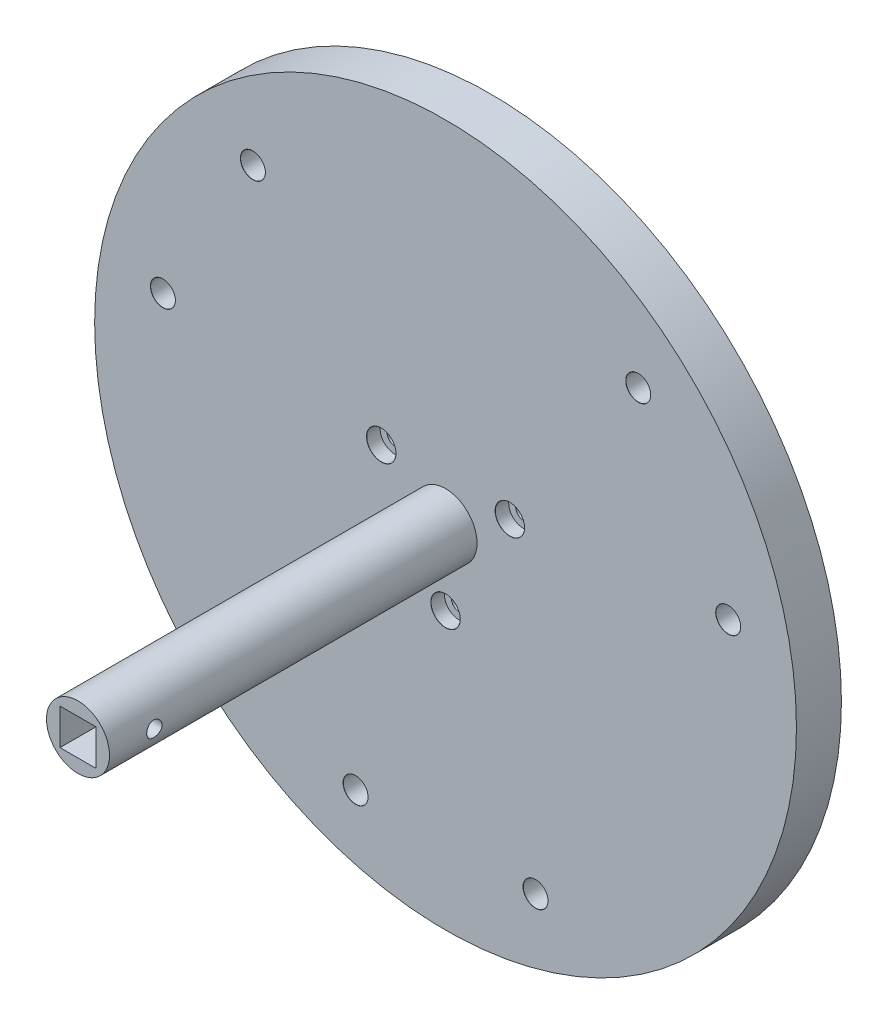
from build123d import *

# Parameters (mm, degrees)
SKETCH1_R                      = 78
BOSS_EXTRUDE1_DEPTH            = 10
CBORE_FOR_M3_SHCS1_AT_2_COUNT  = 2
CBORE_FOR_M3_SHCS1_AT_2_PITCH  = 28.578838325
CBORE_FOR_M3_SHCS1_AT_3_COUNT  = 2
CBORE_FOR_M3_SHCS1_AT_3_PITCH  = 28.578838325
SKETCH6_R                      = 7
BOSS_EXTRUDE2_DEPTH            = 81.7
SKETCH20_W                     = 8
SKETCH20_H                     = 8
CUT_EXTRUDE1_DEPTH             = 20
M5_CLEARANCE_HOLE3_D           = 5.5
M5_CLEARANCE_HOLE3_CSINK_D     = 5.55
M5_CLEARANCE_HOLE3_CSINK_ANGLE = 90
CIRPATTERN1_COUNT              = 3
M3_CLEARANCE_HOLE2_D           = 3.4
M3_CLEARANCE_HOLE2_CSINK_D     = 3.45
M3_CLEARANCE_HOLE2_CSINK_ANGLE = 90


with BuildPart() as part:
    # Sketch1 → Boss-Extrude1 (new body)
    with BuildSketch(Plane.XY):
        Circle(SKETCH1_R)
    extrude(amount=BOSS_EXTRUDE1_DEPTH)

    # Sketch4 → CBORE for M3 SHCS1 (revolve, cut)
    with BuildSketch(Plane(origin=(-14.289419162, 8.25, 10), x_dir=(0, -1, 0), z_dir=(1, 0, 0))):
        Polygon((0, 0), (0, 10), (1.7, 10), (1.7, 3), (3.25, 3), (3.25, 0.025), (3.275, 0), align=None)
    cbore_for_m3_shcs1 = revolve(axis=Axis((-14.289419162, 8.25, 16.35), (0, 0, -1)), mode=Mode.SUBTRACT)

    # CBORE for M3 SHCS1 at 2: CBORE for M3 SHCS1 ×2
    with Locations(*[(i * CBORE_FOR_M3_SHCS1_AT_2_PITCH, 0, 0) for i in range(1, CBORE_FOR_M3_SHCS1_AT_2_COUNT)]):
        add(cbore_for_m3_shcs1, mode=Mode.SUBTRACT)

    # CBORE for M3 SHCS1 at 3: CBORE for M3 SHCS1 ×2
    with Locations(*[Vector(0.5000000000000012, -0.866025403784438, 0) * (i * CBORE_FOR_M3_SHCS1_AT_3_PITCH) for i in range(1, CBORE_FOR_M3_SHCS1_AT_3_COUNT)]):
        add(cbore_for_m3_shcs1, mode=Mode.SUBTRACT)

    # Sketch6 → Boss-Extrude2 (add)
    with BuildSketch(Plane.XY.offset(10)):
        Circle(SKETCH6_R)
    extrude(amount=BOSS_EXTRUDE2_DEPTH)

    # Sketch20 → Cut-Extrude1 (cut)
    with BuildSketch(Plane.XY.offset(91.7)):
        Rectangle(SKETCH20_W, SKETCH20_H)
    extrude(amount=-CUT_EXTRUDE1_DEPTH, mode=Mode.SUBTRACT)

    # M5 Clearance Hole3 (through all)
    with Locations(Plane.XY.offset(10)):
        with Locations((-20, -61), (20, -61)):
            m5_clearance_hole3 = CounterSinkHole(M5_CLEARANCE_HOLE3_D / 2, M5_CLEARANCE_HOLE3_CSINK_D / 2, counter_sink_angle=M5_CLEARANCE_HOLE3_CSINK_ANGLE)

    # CirPattern1: M5 Clearance Hole3 ×3 about axis
    cirpattern1_axis = Axis((0, 0, 0), (0, 0, 1))
    for i in range(1, CIRPATTERN1_COUNT):
        add(m5_clearance_hole3.rotate(cirpattern1_axis, i * 360 / CIRPATTERN1_COUNT), mode=Mode.SUBTRACT)

    # M3 Clearance Hole2 (through all)
    with Locations(Plane(origin=(7, 0, 0), x_dir=(0, 0, -1), z_dir=(1, 0, 0))):
        with Locations((-81.7, 0)):
            CounterSinkHole(M3_CLEARANCE_HOLE2_D / 2, M3_CLEARANCE_HOLE2_CSINK_D / 2, counter_sink_angle=M3_CLEARANCE_HOLE2_CSINK_ANGLE)


solid = part.part
